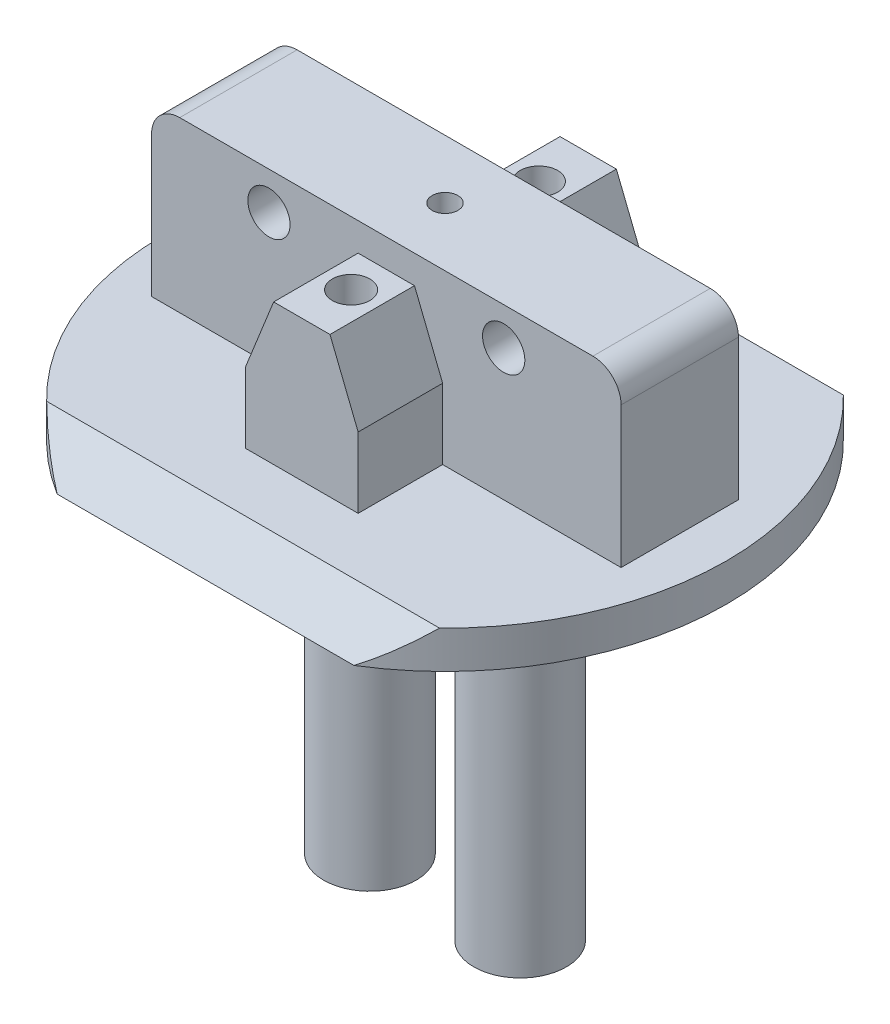
from build123d import *
from build123d.topology import SkipClean

# Parameters (mm, degrees)
SKETCH1_R                            = 30
BOSS_EXTRUDE1_DEPTH                  = 4
BOSS_EXTRUDE2_REACH                  = 44.615
BOSS_EXTRUDE2_END_RADIUS             = 30
BOSS_EXTRUDE2_DIRECTION_2_REACH      = 44.615
BOSS_EXTRUDE2_DIRECTION_2_END_RADIUS = 30
SKETCH3_OUTSIDE_W                    = 78.092
SKETCH3_OUTSIDE_H                    = 69.092
SKETCH3_OUTSIDE_R                    = 21.5
CUT_EXTRUDE2_DEPTH                   = 12.5
BOSS_EXTRUDE3_DEPTH                  = 18
BOSS_EXTRUDE4_DEPTH                  = 15
BOSS_EXTRUDE5_DEPTH                  = 15
CUT_EXTRUDE3_DEPTH                   = 44.292609069
CUT_EXTRUDE3_DEPTH_BACK              = 44.292609069
SKETCH8_R                            = 2
CUT_EXTRUDE8_DEPTH                   = 48.077064479
CUT_EXTRUDE8_DEPTH_BACK              = 48.077064479
CUT_EXTRUDE9_DEPTH                   = 59.659818207
CUT_EXTRUDE11_DEPTH                  = 20
CUT_EXTRUDE12_DEPTH                  = 20
CUT_EXTRUDE13_DEPTH                  = 20
CUT_EXTRUDE14_DEPTH                  = 44.292609069
CUT_EXTRUDE14_DEPTH_BACK             = 44.292609069
SKETCH25_W                           = 66.075437062
SKETCH25_H                           = 20.142243048
SKETCH27_R                           = 1.375
CUT_EXTRUDE16_DEPTH                  = 30
SKETCH28_R                           = 5
CUT_EXTRUDE17_DEPTH                  = 3
CUT_EXTRUDE18_DEPTH                  = 43.690748412
CUT_EXTRUDE18_DEPTH_BACK             = 43.690748412
SKETCH29_W                           = 43.412566799
SKETCH29_H                           = 13.326200919
SKETCH32_W                           = 50
SKETCH32_H                           = 12.5
BOSS_EXTRUDE6_DEPTH                  = 18
SKETCH35_W                           = 12
SKETCH35_H                           = 15
BOSS_EXTRUDE7_DEPTH                  = 9
CUT_EXTRUDE19_DEPTH                  = 49.908715992
CUT_EXTRUDE19_DEPTH_BACK             = 49.908715992
SKETCH37_R                           = 2.25
SKETCH36_R                           = 2
CUT_EXTRUDE20_DEPTH                  = 15
SKETCH39_W                           = 12
SKETCH39_H                           = 15
BOSS_EXTRUDE8_DEPTH                  = 9
SKETCH40_R                           = 2
CUT_EXTRUDE21_DEPTH                  = 15
FILLET1_R                            = 3
FILLET2_R                            = 3
CUT_EXTRUDE24_START                  = -20
SKETCH44_R                           = 1.375
CUT_EXTRUDE24_DEPTH                  = 20
SKETCH45_R                           = 4.925
BOSS_EXTRUDE9_DEPTH                  = 42
SKETCH46_R                           = 1.8923
CUT_EXTRUDE25_DEPTH                  = 29.972
SKETCH47_R                           = 1.8923
CUT_EXTRUDE26_DEPTH                  = 29.972
CUT_EXTRUDE32_DEPTH                  = 9
CUT_EXTRUDE33_DEPTH                  = 9
CUT_EXTRUDE34_DEPTH                  = 9
CUT_EXTRUDE35_DEPTH                  = 9


with BuildPart() as part:
    # Sketch1 → Boss-Extrude1 (new body)
    with BuildSketch(Plane(origin=(0, 0, 0), x_dir=(1, 0, 0), z_dir=(0, 1, 0))):
        with Locations(Location((0, 0, 0), (0, 0, 270))):
            Circle(SKETCH1_R)
    extrude(amount=BOSS_EXTRUDE1_DEPTH)

    # Boss-Extrude2: up to this cylinder (the profile starts inside it)
    with SkipClean():  # the faces are left unmerged after this step: merging them gives an invalid solid
        boss_extrude2_end = Plane(origin=(0, 9.396175, 0), z_dir=(0, -1, 0)) * Cylinder(BOSS_EXTRUDE2_END_RADIUS, 150.23, mode=Mode.PRIVATE)
        # Sketch2 → Boss-Extrude2 (add, up to the surface)
        with BuildSketch(Plane(origin=(0, 0, 0), x_dir=(0, 0, -1), z_dir=(1, 0, 0)), mode=Mode.PRIVATE) as boss_extrude2_sk1:
            Polygon((0, 4), (21.5, 4), (9, 16.5), (-9, 16.5), (-21.5, 4), align=None)
        boss_extrude2_tool1 = extrude(boss_extrude2_sk1.sketch, amount=BOSS_EXTRUDE2_REACH, mode=Mode.PRIVATE) & boss_extrude2_end
        add(boss_extrude2_tool1.solids().sort_by_distance((0, 9.396175, 0))[0])

    # Boss-Extrude2 direction 2: up to this cylinder (the profile starts inside it)
    with SkipClean():  # the faces are left unmerged after this step: merging them gives an invalid solid
        boss_extrude2_direction_2_end = Plane(origin=(0, 9.396175, 0), z_dir=(0, -1, 0)) * Cylinder(BOSS_EXTRUDE2_DIRECTION_2_END_RADIUS, 150.23, mode=Mode.PRIVATE)
        # Sketch2 → Boss-Extrude2 direction 2 (add, up to the surface)
        with BuildSketch(Plane(origin=(0, 0, 0), x_dir=(0, 0, -1), z_dir=(1, 0, 0)), mode=Mode.PRIVATE) as boss_extrude2_direction_2_sk1:
            Polygon((0, 4), (21.5, 4), (9, 16.5), (-9, 16.5), (-21.5, 4), align=None)
        boss_extrude2_direction_2_tool1 = extrude(boss_extrude2_direction_2_sk1.sketch, amount=-BOSS_EXTRUDE2_DIRECTION_2_REACH, mode=Mode.PRIVATE) & boss_extrude2_direction_2_end
        add(boss_extrude2_direction_2_tool1.solids().sort_by_distance((0, 9.396175, 0))[0])

    # SurfaceCut1
    split(bisect_by=Plane(origin=(0, 12.75, -12.75), x_dir=(1, 0, 0), z_dir=(0, 0.7071067811865558, -0.7071067811865392)), keep=Keep.BOTTOM)

    # SurfaceCut2
    split(bisect_by=Plane(origin=(0, 12.75, 12.75), x_dir=(1, 0, 0), z_dir=(0, 0.7071067811865509, 0.7071067811865442)), keep=Keep.BOTTOM)

    # Sketch3 outside → Cut-Extrude2 (cut)
    with BuildSketch(Plane(origin=(0, 4, 0), x_dir=(1, 0, 0), z_dir=(0, 1, 0))):
        Rectangle(SKETCH3_OUTSIDE_W, SKETCH3_OUTSIDE_H)
        Circle(SKETCH3_OUTSIDE_R, mode=Mode.SUBTRACT)
    extrude(amount=CUT_EXTRUDE2_DEPTH, mode=Mode.SUBTRACT)

    # Sketch5 → Boss-Extrude3 (add)
    with BuildSketch(Plane(origin=(0, 0, 0), x_dir=(-1, 0, 0), z_dir=(0, -1, 0))):
        Polygon((0, -6), (-17.5, -6), (-17.5, 6), (17.5, 6), (17.5, -6), align=None)
    extrude(amount=BOSS_EXTRUDE3_DEPTH)

    # Sketch6 → Boss-Extrude4 (add)
    with BuildSketch(Plane.XZ):
        Polygon((0, 15), (7, 15), (7, 6), (-7, 6), (-7, 15), align=None)
    extrude(amount=BOSS_EXTRUDE4_DEPTH)

    # Sketch7 → Boss-Extrude5 (add)
    with BuildSketch(Plane.XZ):
        Polygon((0, -15), (7, -15), (7, -6), (-7, -6), (-7, -15), align=None)
    extrude(amount=BOSS_EXTRUDE5_DEPTH)

    # Sketch8 → Cut-Extrude3 (cut, two sides: drawn at the far end of the back side and taken through both)
    with BuildSketch(Plane.XY.offset(-CUT_EXTRUDE3_DEPTH_BACK)):
        with Locations((-12.5, -12.5)):
            Circle(SKETCH8_R)
        with Locations((12.5, -12.5)):
            Circle(SKETCH8_R)
    extrude(amount=CUT_EXTRUDE3_DEPTH + CUT_EXTRUDE3_DEPTH_BACK, mode=Mode.SUBTRACT)

    # Sketch16 → Cut-Extrude8 (cut, two sides: drawn at the far end of the back side and taken through both)
    with BuildSketch(Plane.XY.offset(6).offset(-CUT_EXTRUDE8_DEPTH_BACK)):
        Polygon((17.5, -18), (17.5, -14.5), (14, -18), align=None)
        Polygon((-17.5, -18), (-14, -18), (-17.5, -14.5), align=None)
    extrude(amount=CUT_EXTRUDE8_DEPTH + CUT_EXTRUDE8_DEPTH_BACK, mode=Mode.SUBTRACT)

    # Sketch17 → Cut-Extrude9 (cut, through all)
    with BuildSketch(Plane(origin=(10.365975269, -9.674910251, -8.062425209), x_dir=(-0.3613483622370374, 0.337258471421235, -0.8693009171531012), z_dir=(0.6355070151731325, -0.5931398808282571, -0.49428323402354774))):
        Polygon((-2.372510104, -6.189601271), (7.980636686, -0.706686759), (7.980636686, -10.965829024), align=None)
    extrude(amount=CUT_EXTRUDE9_DEPTH, mode=Mode.SUBTRACT)

    # Sketch19 → Cut-Extrude11 (cut)
    with BuildSketch(Plane(origin=(-10.365975269, -9.674910251, -8.062425209), x_dir=(0.3613483622370374, 0.33725847142123494, -0.8693009171531012), z_dir=(0.6355070151731324, 0.5931398808282571, 0.4942832340235476))):
        Polygon((-2.372510104, -6.189601271), (7.980636686, -10.965829024), (7.980636686, -0.706686759), align=None)
    extrude(amount=-CUT_EXTRUDE11_DEPTH, mode=Mode.SUBTRACT)

    # Sketch20 → Cut-Extrude12 (cut)
    with BuildSketch(Plane(origin=(-10.365975269, -9.674910251, 8.062425209), x_dir=(-0.3613483622370374, -0.3372584714212349, -0.8693009171531013), z_dir=(0.6355070151731326, 0.593139880828257, -0.49428323402354757))):
        Polygon((2.372510104, -6.189601271), (-7.980636686, -0.706686759), (-7.980636686, -10.965829024), align=None)
    extrude(amount=-CUT_EXTRUDE12_DEPTH, mode=Mode.SUBTRACT)

    # Sketch21 → Cut-Extrude13 (cut)
    with BuildSketch(Plane(origin=(10.365975269, -9.674910251, 8.062425209), x_dir=(-0.3613483622370374, 0.3372584714212349, 0.8693009171531013), z_dir=(-0.6355070151731326, 0.593139880828257, -0.49428323402354757))):
        Polygon((-2.372510104, -6.189601271), (7.980636686, -0.706686759), (7.980636686, -10.965829024), align=None)
    extrude(amount=-CUT_EXTRUDE13_DEPTH, mode=Mode.SUBTRACT)

    # Sketch25 → Cut-Extrude14 (cut, two sides: drawn at the far end of the back side and taken through both)
    with BuildSketch(Plane.XY.offset(-CUT_EXTRUDE14_DEPTH_BACK)):
        with Locations((0, -10.071121524)):
            Rectangle(SKETCH25_W, SKETCH25_H)
    extrude(amount=CUT_EXTRUDE14_DEPTH + CUT_EXTRUDE14_DEPTH_BACK, mode=Mode.SUBTRACT)

    # Sketch27 → Cut-Extrude16 (cut)
    with BuildSketch(Plane(origin=(0, 16.5, 0), x_dir=(1, 0, 0), z_dir=(0, 1, 0))):
        with Locations(Location((0, 0, 0), (0, 0, 270))):
            Circle(SKETCH27_R)
    extrude(amount=-CUT_EXTRUDE16_DEPTH, mode=Mode.SUBTRACT)

    # Sketch28 → Cut-Extrude17 (cut)
    with BuildSketch(Plane.XZ):
        with Locations(Location((0, -15, 0), (0, 0, 270))):
            Circle(SKETCH28_R)
        with Locations(Location((22, 0, 0), (0, 0, 270))):
            Circle(SKETCH28_R)
        with Locations(Location((0, 15, 0), (0, 0, 270))):
            Circle(SKETCH28_R)
        with Locations(Location((-22, 0, 0), (0, 0, 270))):
            Circle(SKETCH28_R)
        with Locations(Location((-14, 12, 0), (0, 0, 270))):
            Circle(SKETCH28_R)
        with Locations(Location((14, 12, 0), (0, 0, 270))):
            Circle(SKETCH28_R)
        with Locations(Location((14, -12, 0), (0, 0, 270))):
            Circle(SKETCH28_R)
        with Locations(Location((-14, -12, 0), (0, 0, 270))):
            Circle(SKETCH28_R)
    extrude(amount=-CUT_EXTRUDE17_DEPTH, mode=Mode.SUBTRACT)

    # Sketch29 → Cut-Extrude18 (cut, two sides: drawn at the far end of the back side and taken through both)
    with BuildSketch(Plane(origin=(0, 0, 0), x_dir=(0, 0, -1), z_dir=(1, 0, 0)).offset(-CUT_EXTRUDE18_DEPTH_BACK)):
        with Locations((0.2062834, 10.66310046)):
            Rectangle(SKETCH29_W, SKETCH29_H)
    extrude(amount=CUT_EXTRUDE18_DEPTH + CUT_EXTRUDE18_DEPTH_BACK, mode=Mode.SUBTRACT)

    # Sketch32 → Boss-Extrude6 (add)
    with BuildSketch(Plane(origin=(0, 4, 0), x_dir=(1, 0, 0), z_dir=(0, 1, 0))):
        Rectangle(SKETCH32_W, SKETCH32_H)
    extrude(amount=BOSS_EXTRUDE6_DEPTH)

    # Sketch35 → Boss-Extrude7 (add)
    with BuildSketch(Plane(origin=(0, 0, -6.25), x_dir=(-1, 0, 0), z_dir=(0, 0, -1))):
        with Locations((0, 11.5)):
            Rectangle(SKETCH35_W, SKETCH35_H)
    extrude(amount=BOSS_EXTRUDE7_DEPTH)

    # Sketch37 → Cut-Extrude19 (cut, two sides: drawn at the far end of the back side and taken through both)
    with BuildSketch(Plane(origin=(0, 0, -6.25), x_dir=(-1, 0, 0), z_dir=(0, 0, -1)).offset(-CUT_EXTRUDE19_DEPTH_BACK)):
        with Locations((-12.5, 18)):
            Circle(SKETCH37_R)
        with Locations((12.5, 18)):
            Circle(SKETCH37_R)
    extrude(amount=CUT_EXTRUDE19_DEPTH + CUT_EXTRUDE19_DEPTH_BACK, mode=Mode.SUBTRACT)

    # Sketch36 → Cut-Extrude20 (cut)
    with BuildSketch(Plane(origin=(0, 19, 0), x_dir=(1, 0, 0), z_dir=(0, 1, 0))):
        with Locations(Location((0, 10, 0), (0, 0, 270))):
            Circle(SKETCH36_R)
    extrude(amount=-CUT_EXTRUDE20_DEPTH, mode=Mode.SUBTRACT)

    # Sketch39 → Boss-Extrude8 (add)
    with BuildSketch(Plane.XY.offset(6.25)):
        with Locations((0, 11.5)):
            Rectangle(SKETCH39_W, SKETCH39_H)
    extrude(amount=BOSS_EXTRUDE8_DEPTH)

    # Sketch40 → Cut-Extrude21 (cut)
    with BuildSketch(Plane(origin=(0, 19, 0), x_dir=(1, 0, 0), z_dir=(0, 1, 0))):
        with Locations(Location((0, -10, 0), (0, 0, 270))):
            Circle(SKETCH40_R)
    extrude(amount=-CUT_EXTRUDE21_DEPTH, mode=Mode.SUBTRACT)

    # Fillet1
    fillet1_edges = [part.edges().sort_by_distance(p)[0] for p in [
        (25, 22, 0),
    ]]
    fillet(fillet1_edges, radius=FILLET1_R)

    # Fillet2
    fillet2_edges = [part.edges().sort_by_distance(p)[0] for p in [
        (-25, 22, 0),
    ]]
    fillet(fillet2_edges, radius=FILLET2_R)

    # Sketch44 → Cut-Extrude24 (cut)
    with BuildSketch(Plane.XZ.offset(-4).offset(CUT_EXTRUDE24_START)):
        with Locations(Location((0, 0, 0), (0, 0, 90))):
            Circle(SKETCH44_R)
    extrude(amount=CUT_EXTRUDE24_DEPTH, mode=Mode.SUBTRACT)

    # Sketch45 → Boss-Extrude9 (add)
    with BuildSketch(Plane.XZ):
        with Locations(Location((-8, 0, 0), (0, 0, 90))):
            Circle(SKETCH45_R)
        with Locations(Location((8, 0, 0), (0, 0, 90))):
            Circle(SKETCH45_R)
    extrude(amount=BOSS_EXTRUDE9_DEPTH)

    # Sketch46 → Cut-Extrude25 (cut)
    with BuildSketch(Plane.XZ.offset(42)):
        with Locations(Location((-8, 0, 0), (0, 0, 270))):
            Circle(SKETCH46_R)
    extrude(amount=-CUT_EXTRUDE25_DEPTH, mode=Mode.SUBTRACT)

    # Sketch47 → Cut-Extrude26 (cut)
    with BuildSketch(Plane.XZ.offset(42)):
        with Locations(Location((8, 0, 0), (0, 0, 270))):
            Circle(SKETCH47_R)
    extrude(amount=-CUT_EXTRUDE26_DEPTH, mode=Mode.SUBTRACT)

    # Sketch58 → Cut-Extrude32 (cut)
    with BuildSketch(Plane(origin=(0, 0, -15.25), x_dir=(-1, 0, 0), z_dir=(0, 0, -1))):
        Polygon((6, 19), (6, 11.5), (3, 19), align=None)
    extrude(amount=-CUT_EXTRUDE32_DEPTH, mode=Mode.SUBTRACT)

    # Sketch59 → Cut-Extrude33 (cut)
    with BuildSketch(Plane(origin=(0, 0, -15.25), x_dir=(-1, 0, 0), z_dir=(0, 0, -1))):
        Polygon((-6, 19), (-6, 11.5), (-3, 19), align=None)
    extrude(amount=-CUT_EXTRUDE33_DEPTH, mode=Mode.SUBTRACT)

    # Sketch60 → Cut-Extrude34 (cut)
    with BuildSketch(Plane.XY.offset(15.25)):
        Polygon((6, 11.5), (6, 19), (3, 19), align=None)
    extrude(amount=-CUT_EXTRUDE34_DEPTH, mode=Mode.SUBTRACT)

    # Sketch61 → Cut-Extrude35 (cut)
    with BuildSketch(Plane.XY.offset(15.25)):
        Polygon((-6, 19), (-6, 11.5), (-3, 19), align=None)
    extrude(amount=-CUT_EXTRUDE35_DEPTH, mode=Mode.SUBTRACT)


solid = part.part
